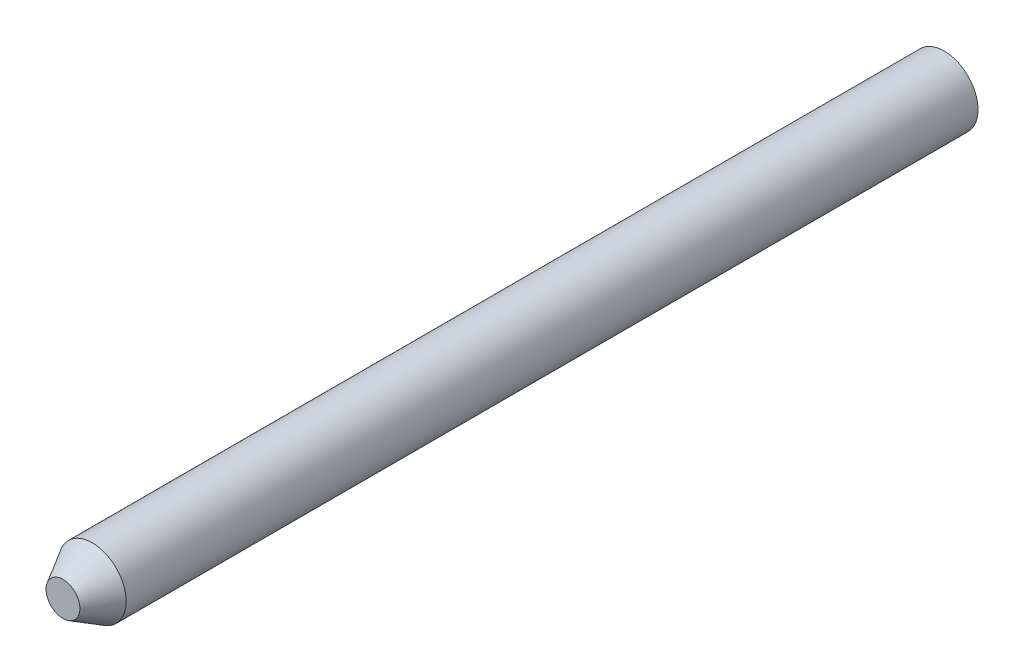
from build123d import *

# Parameters (mm, degrees)
SKETCH1_R           = 2
BOSS_EXTRUDE1_DEPTH = 52
CHAMFER3_SIZE       = 1
CHAMFER3_SIZE2      = 1.732050808


with BuildPart() as part:
    # Sketch1 → Boss-Extrude1 (new body)
    with BuildSketch(Plane.XY):
        Circle(SKETCH1_R)
    extrude(amount=BOSS_EXTRUDE1_DEPTH)

    # Chamfer3
    chamfer3_edges = [part.edges().sort_by_distance(p)[0] for p in [
        (-2, 0, 52),
    ]]
    chamfer3_side = [part.faces().sort_by_distance(p)[0] for p in [
        (0, 0, 52),
    ]]
    chamfer(chamfer3_edges, length=CHAMFER3_SIZE, length2=CHAMFER3_SIZE2, reference=chamfer3_side[0])


solid = part.part
